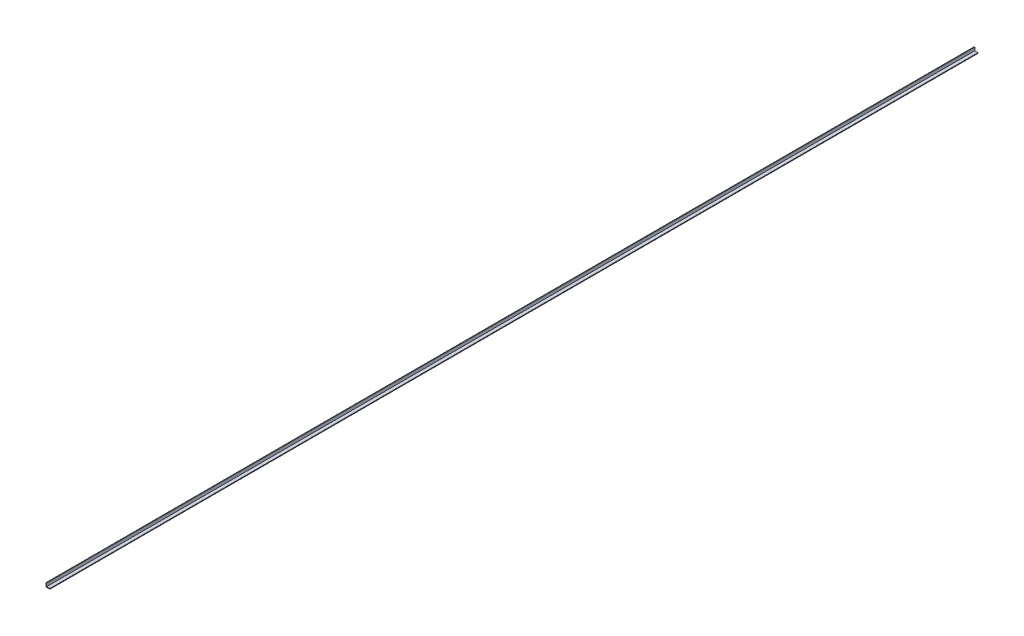
from build123d import *

# Parameters (mm, degrees)
SALIENTE_EXTRUIR1_DEPTH = 6100


with BuildPart() as part:
    # Croquis1 → Saliente-Extruir1 (new body)
    with BuildSketch(Plane.XY):
        Polygon((0, 25.4), (0, 0), (25.4, 0), (25.4, 4.76), (4.76, 4.76), (4.76, 25.4), align=None)
    extrude(amount=-SALIENTE_EXTRUIR1_DEPTH)


solid = part.part
